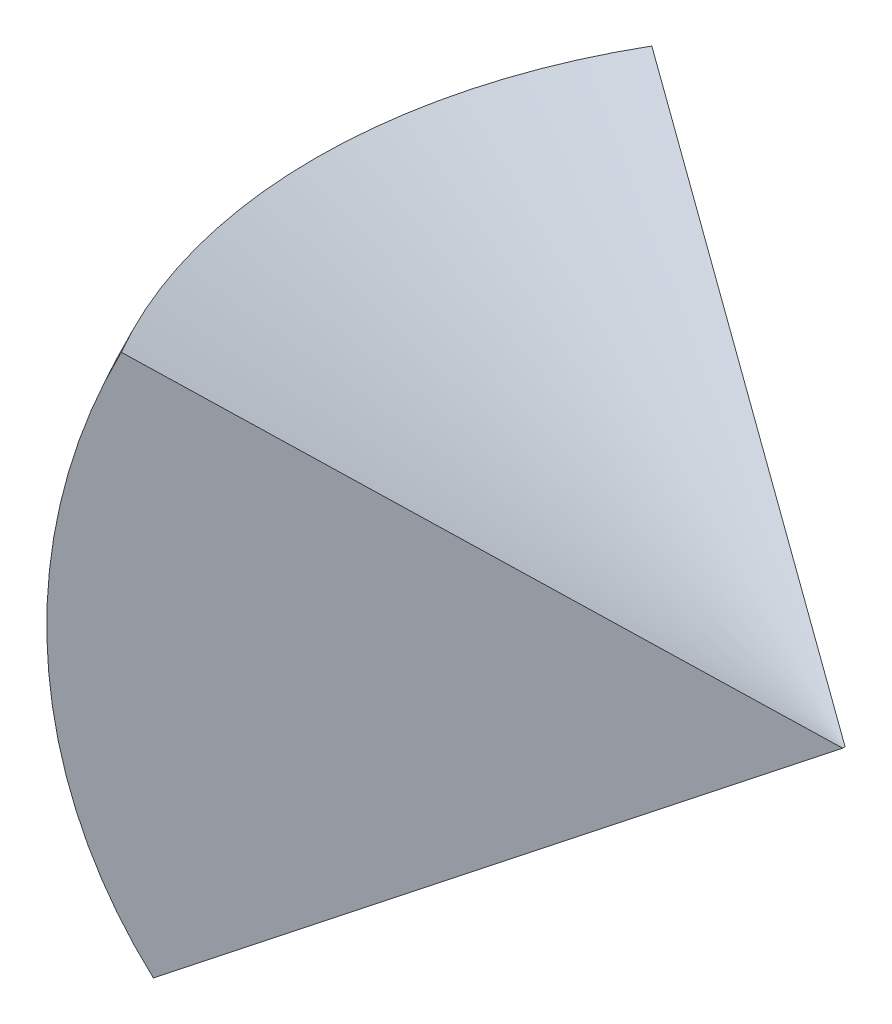
from build123d import *

# Parameters (mm, degrees)
R_VOLUTION5_ANGLE = 60


with BuildPart() as part:
    # Esquisse1 → Révolution5 (revolve, symmetric)
    with BuildSketch(Plane.XY) as r_volution5_sk:
        with BuildLine():
            Line((3.385631662, 0), (-452.549198729, 212.605903031))
            ThreePointArc((-452.549198729, 212.605903031), (-499.203983008, -21.943536473), (-432.284403658, -251.53421217))
            Line((-432.284403658, -251.53421217), (3.385631662, 0))
        make_face()
    revolve(axis=Axis((5.448494446, -756.054679356, 0), (0, 1, 0)), revolution_arc=R_VOLUTION5_ANGLE / 2)
    revolve(r_volution5_sk.sketch, axis=Axis((5.448494446, -756.054679356, 0), (0, -1, 0)), revolution_arc=R_VOLUTION5_ANGLE / 2)


solid = part.part
